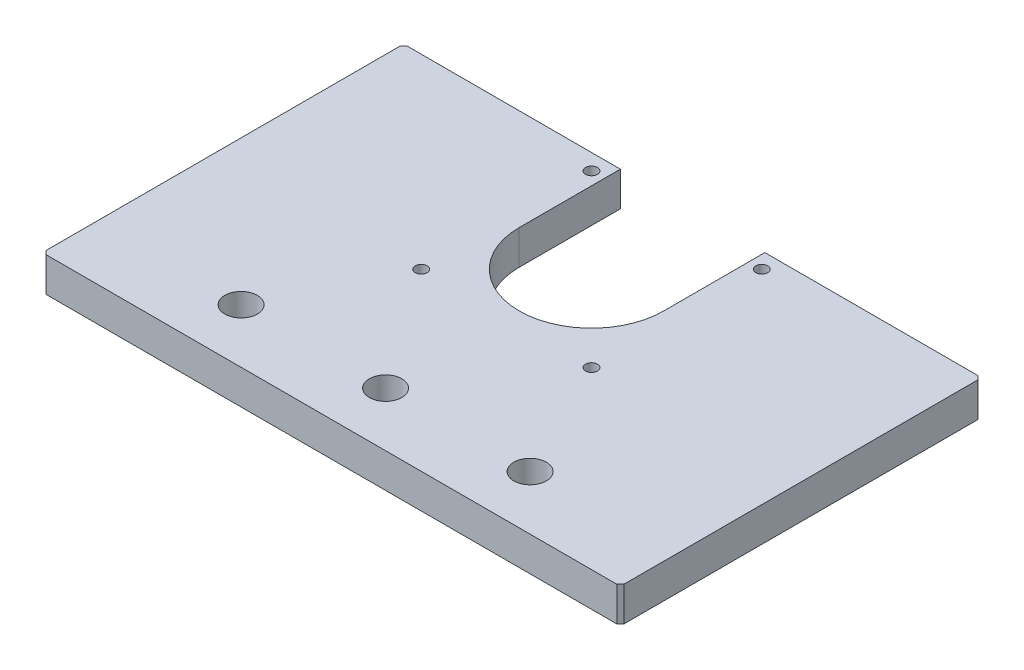
from build123d import *

# Parameters (mm, degrees)
BOSS_EXTRUDE1_DEPTH   = 4.7625
M8_CLEARANCE_HOLE1_D  = 9
M4X0_7_TAPPED_HOLE2_D = 3.3
CHAMFER1_SIZE         = 1


with BuildPart() as part:
    # Sketch1 → Boss-Extrude1 (new, symmetric)
    with BuildSketch(Plane(origin=(0, 0, 0), x_dir=(1, 0, 0), z_dir=(0, 1, 0))):
        with BuildLine():
            Line((20, 0), (20, 28))
            Line((20, 28), (80, 28))
            Line((80, 28), (80, -72))
            Line((80, -72), (-80, -72))
            Line((-80, -72), (-80, 28))
            Line((-80, 28), (-20, 28))
            Line((-20, 28), (-20, 0))
            ThreePointArc((-20, 0), (0, -20), (20, 0))
        make_face()
    extrude(amount=BOSS_EXTRUDE1_DEPTH, both=True)

    # M8 Clearance Hole1 (through all)
    with Locations(Plane(origin=(0, 4.7625, 0), x_dir=(1, 0, 0), z_dir=(0, 1, 0))):
        with Locations((-40, -57), (0, -57), (40, -57)):
            Hole(M8_CLEARANCE_HOLE1_D / 2)

    # M4x0.7 Tapped Hole2 (through all)
    with Locations(Plane(origin=(0, 4.7625, 0), x_dir=(1, 0, 0), z_dir=(0, 1, 0))):
        with Locations((-23.573172318, -23.573172318), (-23.573172318, 23.573172318), (23.573172318, 23.573172318), (23.573172318, -23.573172318)):
            Hole(M4X0_7_TAPPED_HOLE2_D / 2)

    # Chamfer1
    chamfer1_edges = [part.edges().sort_by_distance(p)[0] for p in [
        (80, 0, -28),
        (80, 0, 72),
        (-80, 0, 72),
        (-80, 0, -28),
    ]]
    chamfer(chamfer1_edges, length=CHAMFER1_SIZE)


solid = part.part
